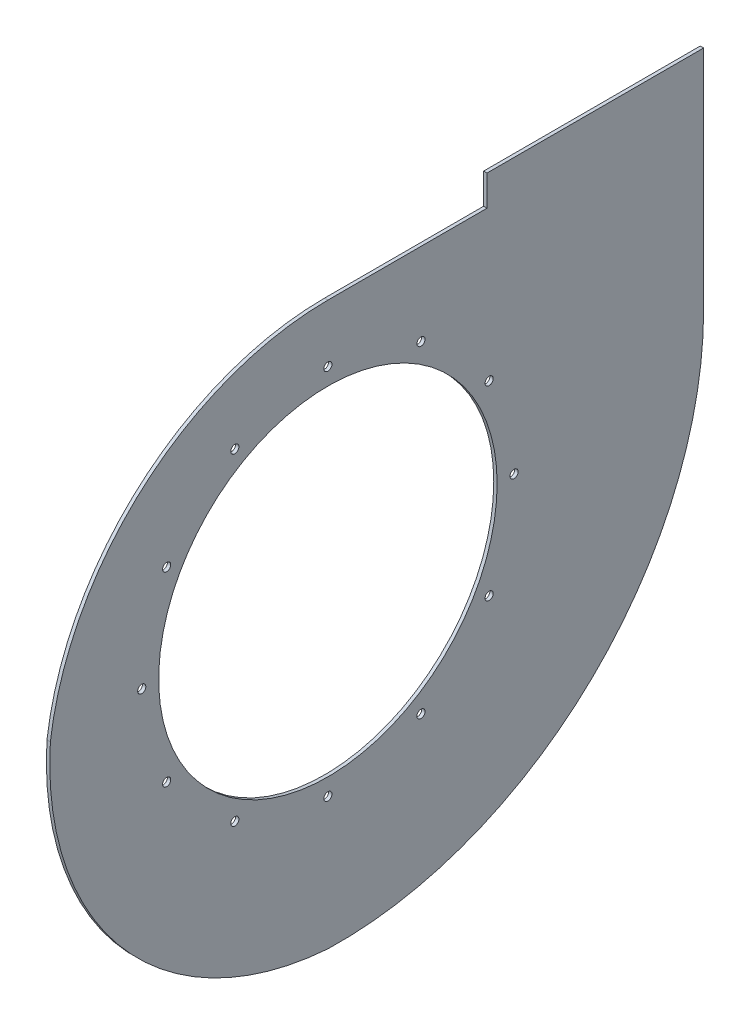
from build123d import *

# Parameters (mm, degrees)
SKETCH1_R           = 250
BOSS_EXTRUDE1_DEPTH = 5
SKETCH2_R           = 6
CUT_EXTRUDE1_DEPTH  = 10
CIRPATTERN1_COUNT   = 12


with BuildPart() as part:
    # Sketch1 → Boss-Extrude1 (new body)
    with BuildSketch(Plane(origin=(0, 0, 0), x_dir=(0, 0, -1), z_dir=(1, 0, 0))):
        with BuildLine():
            Line((-126.985698369, 168.770507744), (193.014301631, 168.770507744))
            Line((193.014301631, 168.770507744), (193.014301631, -166.625210225))
            ThreePointArc((193.014301631, -166.625210225), (29.499330124, -553.664543235), (-361.985698369, -706.229492256))
            ThreePointArc((-361.985698369, -706.229492256), (-663.674001264, -555.574607548), (-771.985698369, -236.229492256))
            ThreePointArc((-771.985698369, -236.229492256), (-634.689640971, 20.877775707), (-361.985698369, 123.770507744))
            Line((-361.985698369, 123.770507744), (-126.985698369, 123.770507744))
            Line((-126.985698369, 123.770507744), (-126.985698369, 168.770507744))
        make_face()
        with Locations((-361.985698369, -236.229492256)):
            Circle(SKETCH1_R, mode=Mode.SUBTRACT)
    extrude(amount=BOSS_EXTRUDE1_DEPTH)

    # Sketch2 → Cut-Extrude1 (cut)
    with BuildSketch(Plane(origin=(5, 0, 0), x_dir=(0, 0, -1), z_dir=(1, 0, 0))):
        with Locations((-86.985698369, -236.229492256)):
            Circle(SKETCH2_R)
    cut_extrude1 = extrude(amount=-CUT_EXTRUDE1_DEPTH, mode=Mode.SUBTRACT)

    # CirPattern1: Cut-Extrude1 ×12 about axis
    cirpattern1_axis = Axis((0, -236.229492256, 361.985698369), (1, 0, 0))
    for i in range(1, CIRPATTERN1_COUNT):
        add(cut_extrude1.rotate(cirpattern1_axis, i * 360 / CIRPATTERN1_COUNT), mode=Mode.SUBTRACT)


solid = part.part
